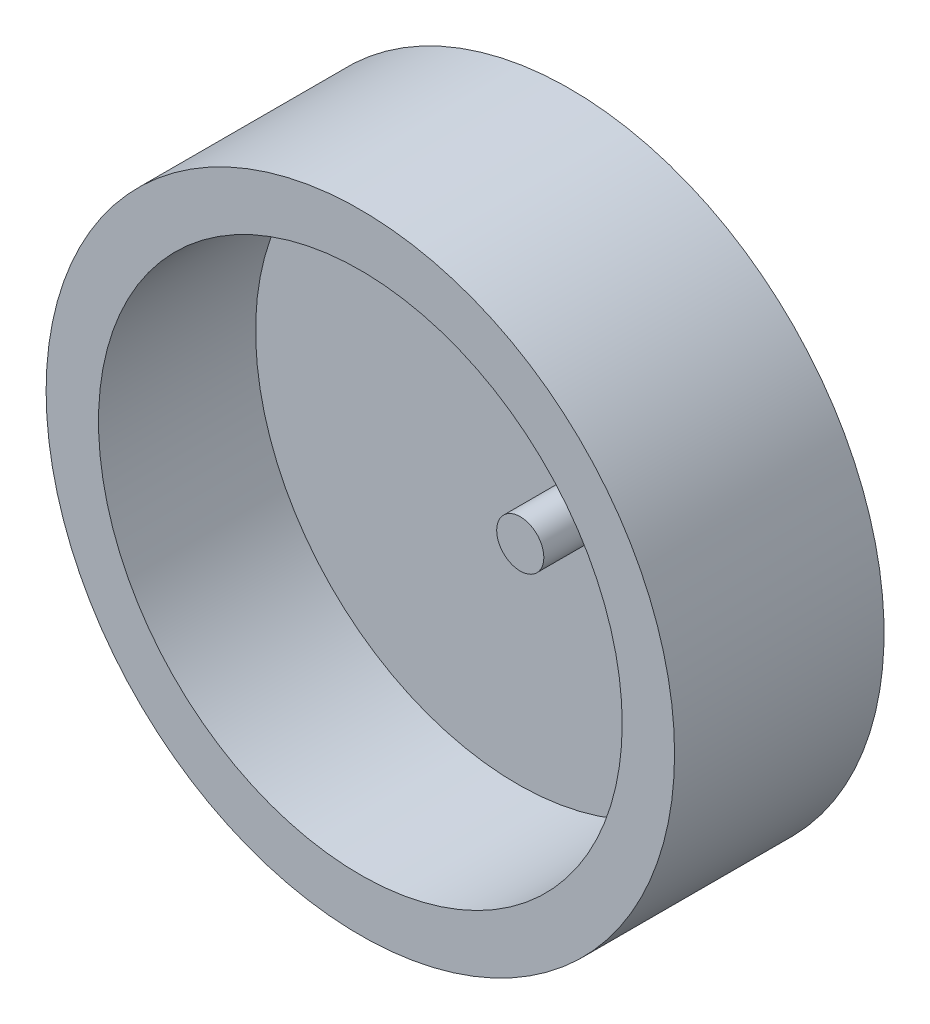
from build123d import *

# Parameters (mm, degrees)
SKETCH1_R           = 60
SKETCH1_R_2         = 50
BOSS_EXTRUDE2_DEPTH = 30
BOSS_EXTRUDE3_START = 10
SKETCH2_R           = 60
BOSS_EXTRUDE3_DEPTH = 10
SKETCH3_R           = 4.5
BOSS_EXTRUDE4_DEPTH = 10


with BuildPart() as part:
    # Sketch1 → Boss-Extrude2 (new body)
    with BuildSketch(Plane.XY):
        Circle(SKETCH1_R)
        Circle(SKETCH1_R_2, mode=Mode.SUBTRACT)
    extrude(amount=BOSS_EXTRUDE2_DEPTH)

    # Sketch2 → Boss-Extrude3 (add)
    with BuildSketch(Plane(origin=(0, 0, 0), x_dir=(-1, 0, 0), z_dir=(0, 0, -1)).offset(BOSS_EXTRUDE3_START)):
        Circle(SKETCH2_R)
    extrude(amount=-BOSS_EXTRUDE3_DEPTH)

    # Sketch3 → Boss-Extrude4 (add)
    with BuildSketch(Plane.XY):
        with Locations(Location((10.534503936, 0, 0), (0, 0, 180))):
            Circle(SKETCH3_R)
    extrude(amount=BOSS_EXTRUDE4_DEPTH)


solid = part.part
